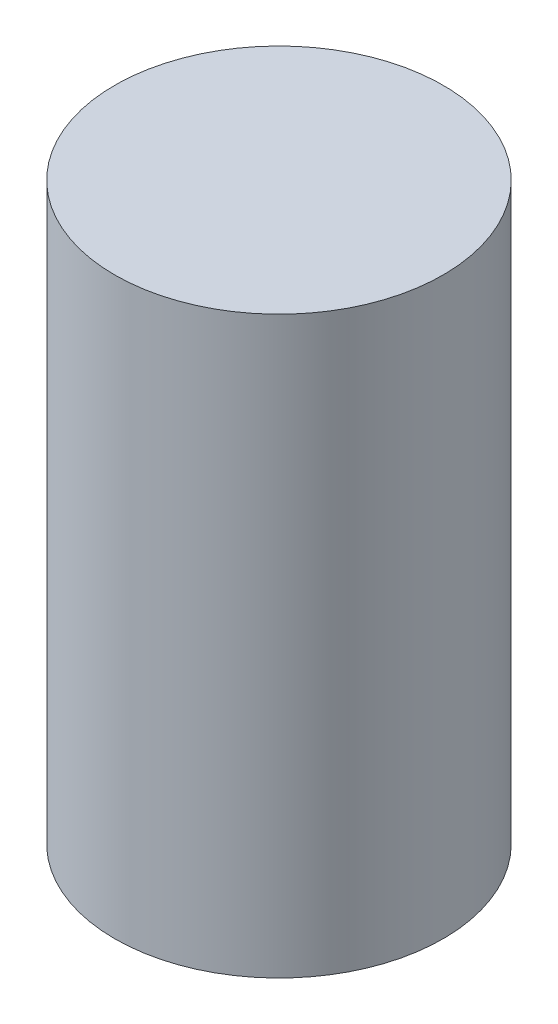
from build123d import *

# Parameters (mm, degrees)
VNT_NIPEL_M8_START = 30
SKETCH1_R          = 4
VNT_NIPEL_M8_DEPTH = 14


with BuildPart() as part:
    # Sketch1 → VNT_nipel_M8 (new body)
    with BuildSketch(Plane(origin=(0, 0, 0), x_dir=(1, 0, 0), z_dir=(0, 1, 0)).offset(VNT_NIPEL_M8_START)):
        with Locations(Location((0, 0, 0), (0, 0, 270))):
            Circle(SKETCH1_R)
    extrude(amount=VNT_NIPEL_M8_DEPTH)


solid = part.part
